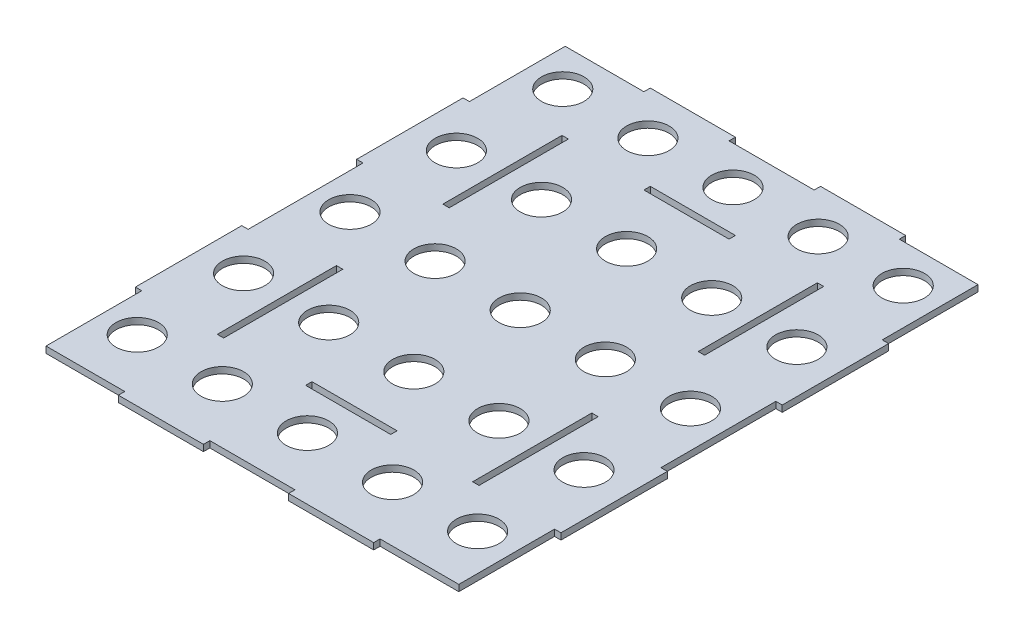
from build123d import *

# Parameters (mm, degrees)
BOSS_EXTRUDE1_DEPTH = 3
SKETCH2_R           = 10
SKETCH2_W           = 3
SKETCH2_H           = 56
SKETCH2_W_2         = 40
SKETCH2_H_2         = 3
CUT_EXTRUDE1_DEPTH  = 166.830173222


with BuildPart() as part:
    # Sketch1 → Boss-Extrude1 (new body)
    with BuildSketch(Plane(origin=(0, 0, 0), x_dir=(1, 0, 0), z_dir=(0, 1, 0))):
        Polygon((15.838364304, 121), (55.838364304, 121), (55.838364304, 118), (92.838364304, 118), (92.838364304, 73), (95.838364304, 73), (95.838364304, 23), (92.838364304, 23), (92.838364304, -31), (95.838364304, -31), (95.838364304, -81), (92.838364304, -81), (92.838364304, -126), (55.838364304, -126), (55.838364304, -129), (15.838364304, -129), (15.838364304, -126), (-24.161635696, -126), (-24.161635696, -129), (-64.161635696, -129), (-64.161635696, -126), (-101.161635696, -126), (-101.161635696, -81), (-104.161635696, -81), (-104.161635696, -31), (-101.161635696, -31), (-101.161635696, 23), (-104.161635696, 23), (-104.161635696, 73), (-101.161635696, 73), (-101.161635696, 118), (-64.161635696, 118), (-64.161635696, 121), (-24.161635696, 121), (-24.161635696, 118), (15.838364304, 118), align=None)
    extrude(amount=BOSS_EXTRUDE1_DEPTH)

    # Sketch2 → Cut-Extrude1 (cut, through all)
    with BuildSketch(Plane(origin=(0, 3, 0), x_dir=(1, 0, 0), z_dir=(0, 1, 0))):
        with Locations(Location((-4.300530568, 0, 0), (0, 0, 270))):
            Circle(SKETCH2_R)
        with Locations(Location((35.699469432, 0, 0), (0, 0, 270))):
            Circle(SKETCH2_R)
        with Locations(Location((75.699469432, 0, 0), (0, 0, 270))):
            Circle(SKETCH2_R)
        with Locations(Location((-44.300530568, 0, 0), (0, 0, 270))):
            Circle(SKETCH2_R)
        with Locations(Location((-84.300530568, 0, 0), (0, 0, 270))):
            Circle(SKETCH2_R)
        with Locations(Location((-84.300530568, 50, 0), (0, 0, 270))):
            Circle(SKETCH2_R)
        with Locations(Location((-44.300530568, 50, 0), (0, 0, 270))):
            Circle(SKETCH2_R)
        with Locations(Location((-4.300530568, 50, 0), (0, 0, 270))):
            Circle(SKETCH2_R)
        with Locations(Location((35.699469432, 50, 0), (0, 0, 270))):
            Circle(SKETCH2_R)
        with Locations(Location((75.699469432, 50, 0), (0, 0, 270))):
            Circle(SKETCH2_R)
        with Locations(Location((-84.300530568, 100, 0), (0, 0, 270))):
            Circle(SKETCH2_R)
        with Locations(Location((-44.300530568, 100, 0), (0, 0, 270))):
            Circle(SKETCH2_R)
        with Locations(Location((-4.300530568, 100, 0), (0, 0, 270))):
            Circle(SKETCH2_R)
        with Locations(Location((35.699469432, 100, 0), (0, 0, 270))):
            Circle(SKETCH2_R)
        with Locations(Location((75.699469432, 100, 0), (0, 0, 270))):
            Circle(SKETCH2_R)
        with Locations(Location((-84.300530568, -50, 0), (0, 0, 270))):
            Circle(SKETCH2_R)
        with Locations(Location((-44.300530568, -50, 0), (0, 0, 270))):
            Circle(SKETCH2_R)
        with Locations(Location((-4.300530568, -50, 0), (0, 0, 270))):
            Circle(SKETCH2_R)
        with Locations(Location((35.699469432, -50, 0), (0, 0, 270))):
            Circle(SKETCH2_R)
        with Locations(Location((75.699469432, -50, 0), (0, 0, 270))):
            Circle(SKETCH2_R)
        with Locations(Location((-84.300530568, -100, 0), (0, 0, 270))):
            Circle(SKETCH2_R)
        with Locations(Location((-44.300530568, -100, 0), (0, 0, 270))):
            Circle(SKETCH2_R)
        with Locations(Location((-4.300530568, -100, 0), (0, 0, 270))):
            Circle(SKETCH2_R)
        with Locations(Location((35.699469432, -100, 0), (0, 0, 270))):
            Circle(SKETCH2_R)
        with Locations(Location((75.699469432, -100, 0), (0, 0, 270))):
            Circle(SKETCH2_R)
        with Locations((-64.161635696, -53)):
            Rectangle(SKETCH2_W, SKETCH2_H)
        Polygon((-65.661635696, 25), (-65.661635696, 81), (-62.661635696, 81), (-62.661635696, 25), (-64.161635696, 25), align=None)
        Polygon((54.338364304, 81), (57.338364304, 81), (57.338364304, 25), (55.838364304, 25), (54.338364304, 25), align=None)
        with Locations((55.838364304, -53)):
            Rectangle(SKETCH2_W, SKETCH2_H)
        with Locations((-4.161635696, 79.5)):
            Rectangle(SKETCH2_W_2, SKETCH2_H_2)
        with Locations((-4.161635696, -79.5)):
            Rectangle(SKETCH2_W_2, SKETCH2_H_2)
    extrude(amount=-CUT_EXTRUDE1_DEPTH, mode=Mode.SUBTRACT)


solid = part.part
